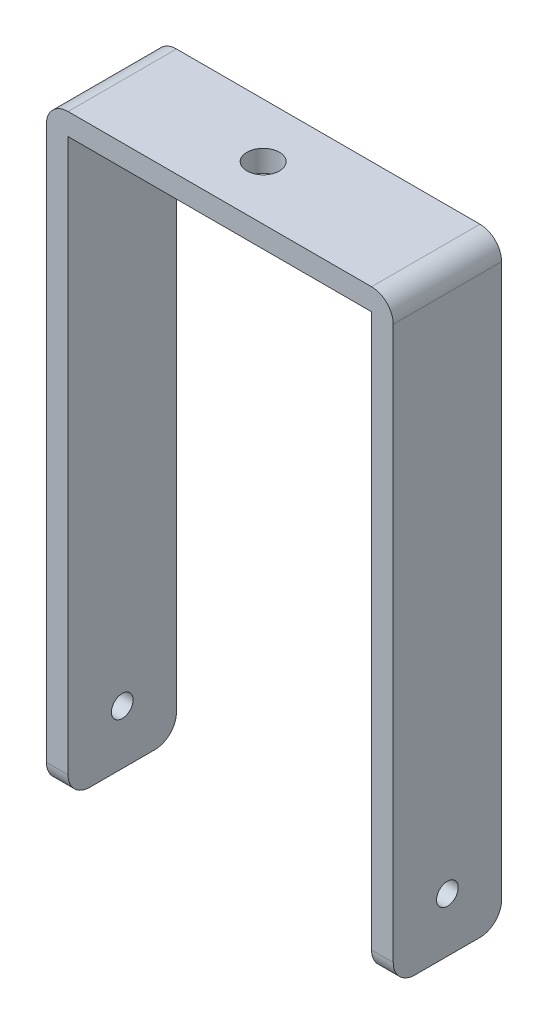
from build123d import *

# Parameters (mm, degrees)
BOSS_EXTRUDE1_DEPTH = 50
FILLET1_R           = 10
SKETCH2_R           = 5
CUT_EXTRUDE1_DEPTH  = 170
SKETCH4_R           = 7.5
CUT_EXTRUDE2_DEPTH  = 10


with BuildPart() as part:
    # Sketch1 → Boss-Extrude1 (new body)
    with BuildSketch(Plane.XY):
        Polygon((0, 0), (0, 275), (160, 275), (160, 0), (150, 0), (150, 265), (10, 265), (10, 0), align=None)
    extrude(amount=BOSS_EXTRUDE1_DEPTH)

    # Fillet1
    fillet1_edges = [part.edges().sort_by_distance(p)[0] for p in [
        (5, 0, 0),
        (0, 275, 25),
        (160, 275, 25),
        (155, 0, 50),
        (5, 0, 50),
        (155, 0, 0),
    ]]
    fillet(fillet1_edges, radius=FILLET1_R)

    # Sketch2 → Cut-Extrude1 (cut)
    with BuildSketch(Plane.ZY):
        with Locations(Location((25, 25, 0), (0, 0, 270))):
            Circle(SKETCH2_R)
    extrude(amount=-CUT_EXTRUDE1_DEPTH, mode=Mode.SUBTRACT)

    # Sketch4 → Cut-Extrude2 (cut)
    with BuildSketch(Plane(origin=(0, 275, 0), x_dir=(1, 0, 0), z_dir=(0, 1, 0))):
        with Locations(Location((75, -25, 0), (0, 0, 270))):
            Circle(SKETCH4_R)
    extrude(amount=-CUT_EXTRUDE2_DEPTH, mode=Mode.SUBTRACT)


solid = part.part
